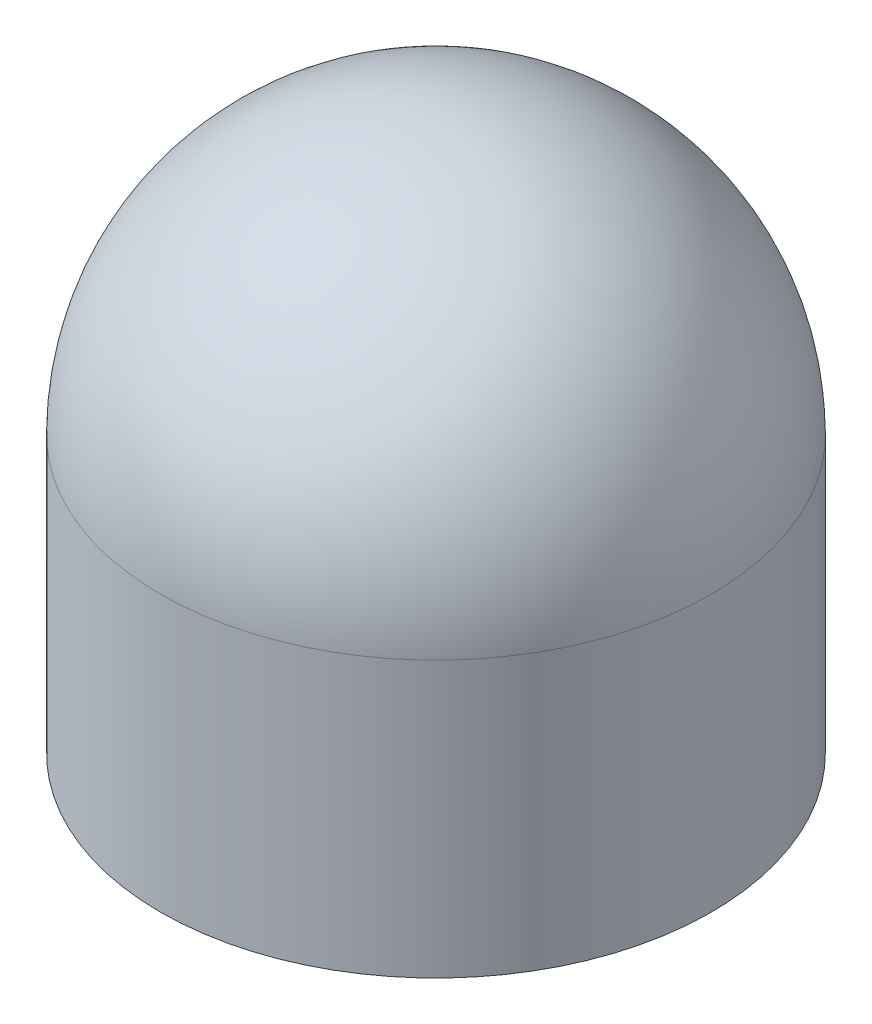
from build123d import *

# Parameters (mm, degrees)
SKETCH2_R          = 1.5
CUT_EXTRUDE1_DEPTH = 3.175


with BuildPart() as part:
    # Sketch1 → Revolve2 (revolve)
    with BuildSketch(Plane(origin=(0, 0, 0), x_dir=(0, 0, -1), z_dir=(1, 0, 0))):
        with BuildLine():
            Line((0, 0), (-3.175, 0))
            Line((-3.175, 0), (-3.175, 3.175))
            ThreePointArc((-3.175, 3.175), (-2.24506403, 5.42006403), (0, 6.35))
            Line((0, 6.35), (0, 0))
        make_face()
    revolve(axis=Axis((0, 0, 0), (0, -1, 0)))

    # Sketch2 → Cut-Extrude1 (cut)
    with BuildSketch(Plane.XZ):
        with Locations(Location((0, 0, 0), (0, 0, 270))):
            Circle(SKETCH2_R)
    extrude(amount=-CUT_EXTRUDE1_DEPTH, mode=Mode.SUBTRACT)


solid = part.part
